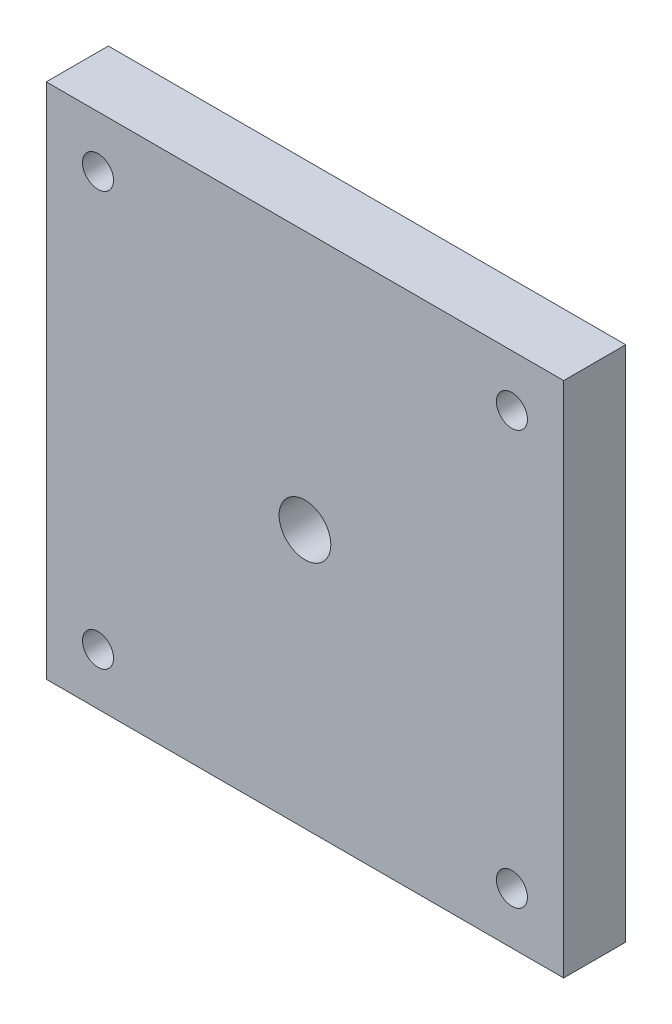
from build123d import *

# Parameters (mm, degrees)
SKETCH_1_W      = 50
SKETCH_1_H      = 50
SKETCH_1_R      = 2.5
SKETCH_1_R_2    = 1.5
EXTRUDE_1_DEPTH = 6


with BuildPart() as part:
    # 草图1 → 凸台-拉伸1 (new body)
    with BuildSketch(Plane.XY):
        Rectangle(SKETCH_1_W, SKETCH_1_H)
        Circle(SKETCH_1_R, mode=Mode.SUBTRACT)
        with Locations((-20, 20)):
            Circle(SKETCH_1_R_2, mode=Mode.SUBTRACT)
        with Locations(Location((20, 20, 0), (0, 0, 180))):
            Circle(SKETCH_1_R_2, mode=Mode.SUBTRACT)
        with Locations((20, -20)):
            Circle(SKETCH_1_R_2, mode=Mode.SUBTRACT)
        with Locations(Location((-20, -20, 0), (0, 0, 180))):
            Circle(SKETCH_1_R_2, mode=Mode.SUBTRACT)
    extrude(amount=EXTRUDE_1_DEPTH)


solid = part.part
